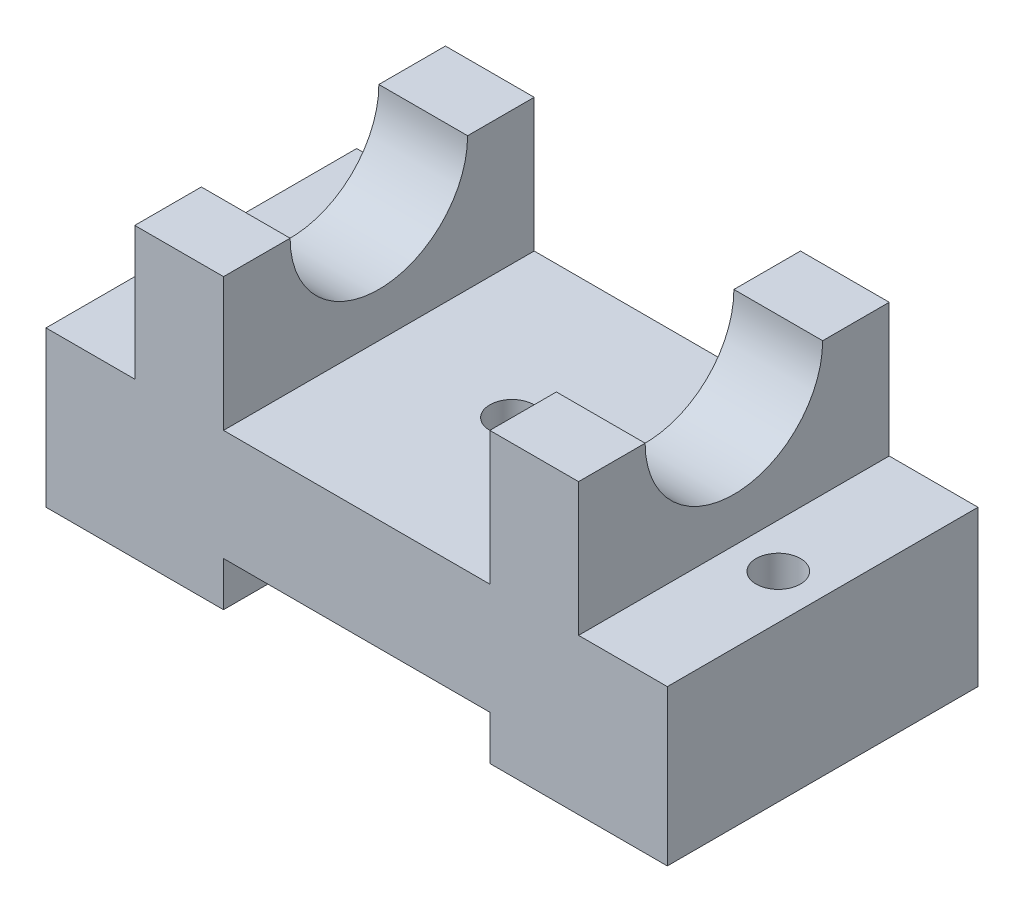
from build123d import *

# Parameters (mm, degrees)
BOSS_EXTRUDE1_DEPTH     = 70
CUT_EXTRUDE1_DEPTH      = 154.378616502
CUT_EXTRUDE1_DEPTH_BACK = 154.378616502
SKETCH4_R               = 5
CUT_EXTRUDE3_DEPTH      = 161.390149323


with BuildPart() as part:
    # Sketch2 → Boss-Extrude1 (new body)
    with BuildSketch(Plane.XY):
        Polygon((0, 0), (40, 0), (40, 10), (100, 10), (100, 0), (140, 0), (140, 35), (120, 35), (120, 65), (100, 65), (100, 35), (40, 35), (40, 65), (20, 65), (20, 35), (0, 35), align=None)
    extrude(amount=-BOSS_EXTRUDE1_DEPTH)

    # Sketch3 → Cut-Extrude1 (cut, two sides: drawn at the far end of the back side and taken through both)
    with BuildSketch(Plane(origin=(120, 0, 0), x_dir=(0, 0, -1), z_dir=(1, 0, 0)).offset(-CUT_EXTRUDE1_DEPTH_BACK)):
        with BuildLine():
            Line((15, 245.293863659), (15, 65))
            ThreePointArc((15, 65), (35, 45), (55, 65))
            Line((55, 65), (55, 245.293863659))
            Line((55, 245.293863659), (55, 605.881590978))
            Line((55, 605.881590978), (15, 605.881590978))
            Line((15, 605.881590978), (15, 245.293863659))
        make_face()
    extrude(amount=CUT_EXTRUDE1_DEPTH + CUT_EXTRUDE1_DEPTH_BACK, mode=Mode.SUBTRACT)

    # Sketch4 → Cut-Extrude3 (cut, through all)
    with BuildSketch(Plane(origin=(0, 35, 0), x_dir=(1, 0, 0), z_dir=(0, 1, 0))):
        with Locations(Location((130, 35, 0), (0, 0, 180))):
            Circle(SKETCH4_R)
        with Locations(Location((10, 35, 0), (0, 0, 180))):
            Circle(SKETCH4_R)
        with Locations(Location((70, 35, 0), (0, 0, 180))):
            Circle(SKETCH4_R)
    extrude(amount=-CUT_EXTRUDE3_DEPTH, mode=Mode.SUBTRACT)


solid = part.part
